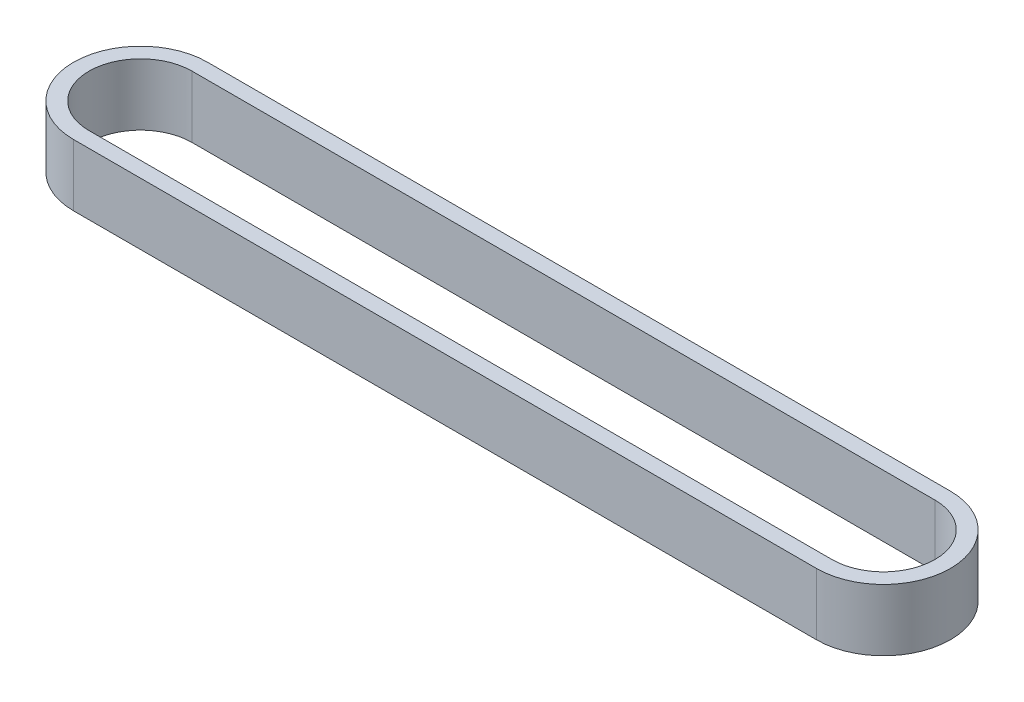
from build123d import *

# Parameters (mm, degrees)
BOSS_EXTRUDE1_DEPTH = 3


with BuildPart() as part:
    # Sketch1 → Boss-Extrude1 (new, symmetric)
    with BuildSketch(Plane(origin=(0, 0, 0), x_dir=(1, 0, 0), z_dir=(0, 1, 0))):
        with BuildLine():
            Line((0, 6.5), (72.12, 6.5))
            ThreePointArc((72.12, 6.5), (78.62, 0), (72.12, -6.5))
            Line((72.12, -6.5), (0, -6.5))
            ThreePointArc((0, -6.5), (-6.5, 0), (0, 6.5))
        make_face()
        with BuildLine():
            Line((0, 5), (72.12, 5))
            ThreePointArc((72.12, 5), (77.12, 0), (72.12, -5))
            Line((72.12, -5), (0, -5))
            ThreePointArc((0, -5), (-5, 0), (0, 5))
        make_face(mode=Mode.SUBTRACT)
    extrude(amount=BOSS_EXTRUDE1_DEPTH, both=True)


solid = part.part
